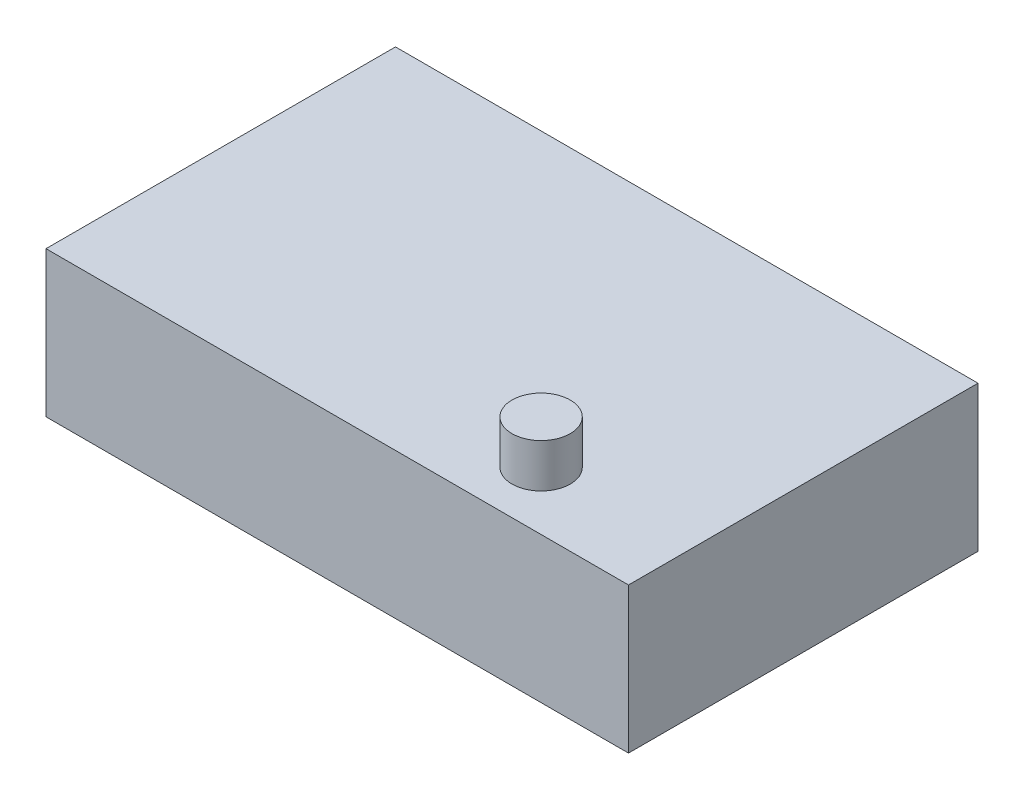
from build123d import *

# Parameters (mm, degrees)
SKETCH1_W           = 20
SKETCH1_H           = 12
BOSS_EXTRUDE1_DEPTH = 5
SKETCH2_R           = 1
BOSS_EXTRUDE2_DEPTH = 1.5


with BuildPart() as part:
    # Sketch1 → Boss-Extrude1 (new body)
    with BuildSketch(Plane(origin=(0, 0, 0), x_dir=(1, 0, 0), z_dir=(0, 1, 0))):
        Rectangle(SKETCH1_W, SKETCH1_H)
    extrude(amount=BOSS_EXTRUDE1_DEPTH)

    # Sketch2 → Boss-Extrude2 (add)
    with BuildSketch(Plane(origin=(0, 5, 0), x_dir=(1, 0, 0), z_dir=(0, 1, 0))):
        with Locations(Location((5, -4, 0), (0, 0, 270))):
            Circle(SKETCH2_R)
    extrude(amount=BOSS_EXTRUDE2_DEPTH)


solid = part.part
